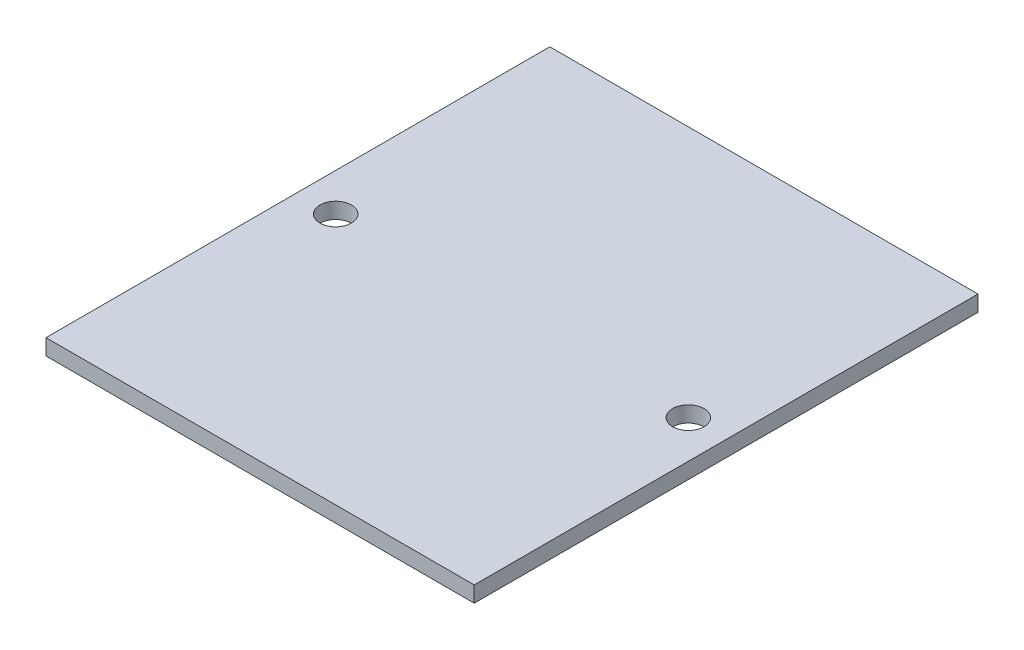
from build123d import *

# Parameters (mm, degrees)
SKETCH1_W           = 43.18
SKETCH1_H           = 50.8
SKETCH1_R           = 1.5875
BOSS_EXTRUDE2_DEPTH = 1.6002


with BuildPart() as part:
    # Sketch1 → Boss-Extrude2 (new body)
    with BuildSketch(Plane(origin=(0, 0, 0), x_dir=(1, 0, 0), z_dir=(0, 1, 0))):
        Rectangle(SKETCH1_W, SKETCH1_H)
        with Locations(Location((-17.78, 0, 0), (0, 0, 270))):
            Circle(SKETCH1_R, mode=Mode.SUBTRACT)
        with Locations(Location((17.78, 0, 0), (0, 0, 270))):
            Circle(SKETCH1_R, mode=Mode.SUBTRACT)
    extrude(amount=BOSS_EXTRUDE2_DEPTH)


solid = part.part
